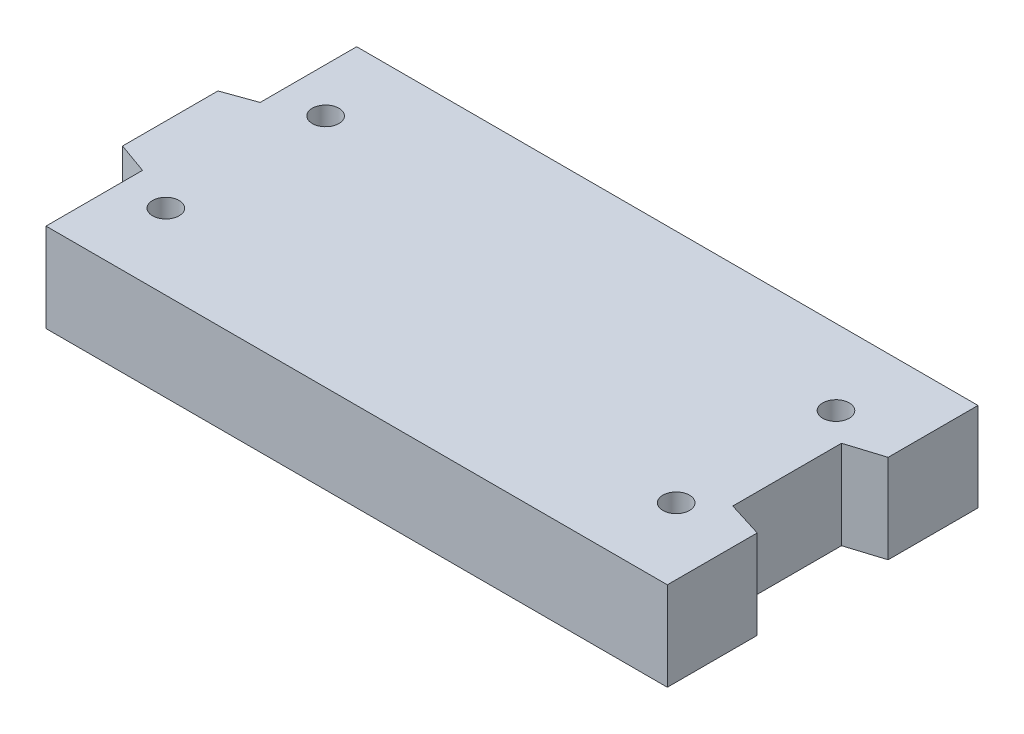
from build123d import *

# Parameters (mm, degrees)
ESTRUSIONE1_DEPTH                   = 40
SCHIZZO5_R                          = 40.25
ESTRUSIONE4_DEPTH                   = 12.5
SFORMO2_ANGLE                       = 25
RACCORDO1_R                         = 3
RACCORDO2_R                         = 5
RIPETIZIONE_A_L1_COUNT              = 2
RIPETIZIONE_A_L1_PITCH              = 141
SFORMO2_OF_RIPETIZIONE_A_L1_2_ANGLE = 25
RACCORDO1_OF_RIPETIZIONE_A_L1_R     = 3
RACCORDO2_OF_RIPETIZIONE_A_L1_R     = 5
M12_TAPPED_HOLE1_D                  = 10.2
M12_TAPPED_HOLE1_DEPTH              = 32.75
M12_TAPPED_HOLE1_CBORE_D            = 12
M12_TAPPED_HOLE1_CBORE_DEPTH        = 24
M12_TAPPED_HOLE1_TIP                = 3.064389157


with BuildPart() as part:
    # Schizzo2 → Estrusione1 (new body)
    with BuildSketch(Plane(origin=(0, 0, 0), x_dir=(1, 0, 0), z_dir=(0, 1, 0))):
        Polygon((-162.652486086, 21.5), (-162.652486086, -21.5), (-148.652486086, -26.5), (-148.652486086, -66), (-148.652486086, -70), (-144.652486086, -70), (127.347513914, -70), (131.347513914, -70), (131.347513914, -66), (131.347513914, -29.5), (115.347513914, -24.5), (115.347513914, 24.5), (131.347513914, 29.5), (131.347513914, 66), (131.347513914, 70), (127.347513914, 70), (-144.652486086, 70), (-148.652486086, 70), (-148.652486086, 66), (-148.652486086, 26.5), align=None)
    extrude(amount=ESTRUSIONE1_DEPTH)

    # Schizzo5 → Estrusione4 (cut)
    with BuildSketch(Plane.XZ):
        with Locations(Location((-80.652486086, 0, 0), (0, 0, 270))):
            Circle(SCHIZZO5_R)
    estrusione4 = extrude(amount=-ESTRUSIONE4_DEPTH, mode=Mode.SUBTRACT)

    # Sformo2
    sformo2_faces = [part.faces().sort_by_distance(p)[0] for p in [
        (-80.652486086, 6.25, 40.25),
    ]]
    draft(sformo2_faces, Plane(origin=(131.347513914, 0, 29.5), x_dir=(0, 0, -1), z_dir=(0, -1, 0)), SFORMO2_ANGLE)

    # Raccordo1
    raccordo1_edges = [part.edges().sort_by_distance(p)[0] for p in [
        (-80.652486086, 0, 40.25),
    ]]
    fillet(raccordo1_edges, radius=RACCORDO1_R)

    # Raccordo2
    raccordo2_edges = [part.edges().sort_by_distance(p)[0] for p in [
        (-80.652486086, 12.5, 34.421154273),
    ]]
    fillet(raccordo2_edges, radius=RACCORDO2_R)

    # Ripetizione a L1: Estrusione4 ×2
    with Locations(*[(i * RIPETIZIONE_A_L1_PITCH, 0, 0) for i in range(1, RIPETIZIONE_A_L1_COUNT)]):
        add(estrusione4, mode=Mode.SUBTRACT)

    # Sformo2 of Ripetizione a L1 2
    sformo2_of_ripetizione_a_l1_2_faces = [part.faces().sort_by_distance(p)[0] for p in [
        (60.347513914, 6.25, 40.25),
    ]]
    draft(sformo2_of_ripetizione_a_l1_2_faces, Plane(origin=(272.347513914, 0, 29.5), x_dir=(0, 0, -1), z_dir=(0, -1, 0)), SFORMO2_OF_RIPETIZIONE_A_L1_2_ANGLE)

    # Raccordo1 of Ripetizione a L1
    raccordo1_of_ripetizione_a_l1_edges = [part.edges().sort_by_distance(p)[0] for p in [
        (60.347513914, 0, 40.25),
    ]]
    fillet(raccordo1_of_ripetizione_a_l1_edges, radius=RACCORDO1_OF_RIPETIZIONE_A_L1_R)

    # Raccordo2 of Ripetizione a L1
    raccordo2_of_ripetizione_a_l1_edges = [part.edges().sort_by_distance(p)[0] for p in [
        (60.347513914, 12.5, 34.421154273),
    ]]
    fillet(raccordo2_of_ripetizione_a_l1_edges, radius=RACCORDO2_OF_RIPETIZIONE_A_L1_R)

    # M12 Tapped Hole1
    with Locations(Plane(origin=(-128.652486086, 40, -36), x_dir=(0, 0, 1), z_dir=(0, 1, 0))):
        with Locations((0, 0), (0, 230), (72, 230), (72, 0)):
            CounterBoreHole(M12_TAPPED_HOLE1_D / 2, M12_TAPPED_HOLE1_CBORE_D / 2, M12_TAPPED_HOLE1_CBORE_DEPTH, depth=M12_TAPPED_HOLE1_DEPTH)
            with Locations((0, 0, -(M12_TAPPED_HOLE1_DEPTH + M12_TAPPED_HOLE1_TIP / 2))):  # 118° drill point
                Cone(0, M12_TAPPED_HOLE1_D / 2, M12_TAPPED_HOLE1_TIP, mode=Mode.SUBTRACT)


solid = part.part
